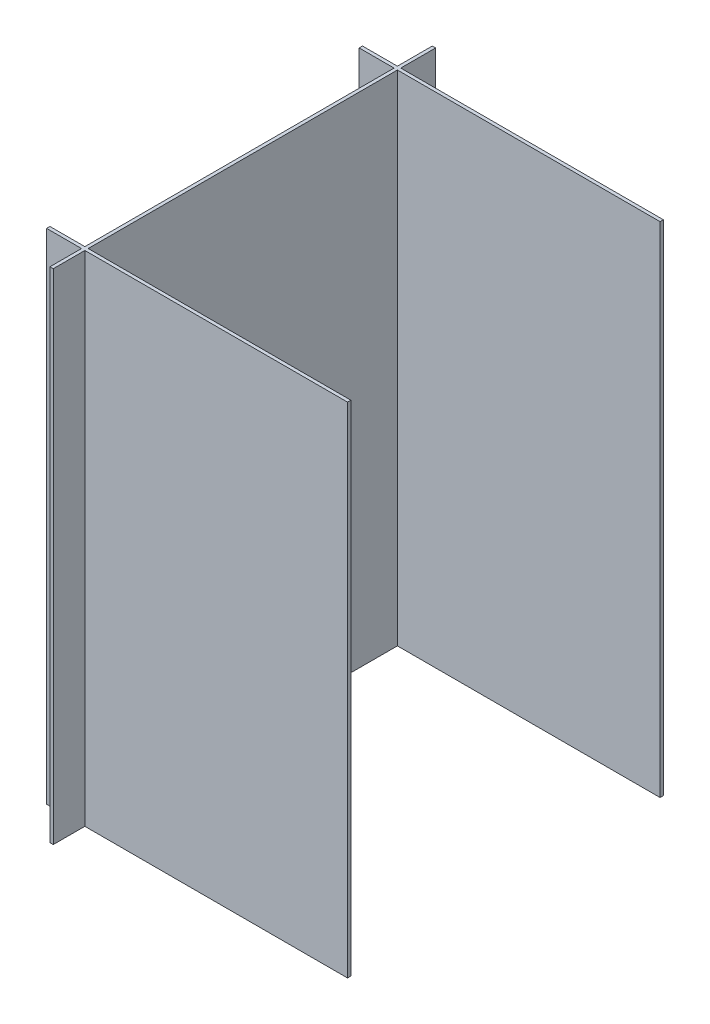
from build123d import *

# Parameters (mm, degrees)
BOSS_EXTRUDE1_DEPTH = 300


with BuildPart() as part:
    # Sketch1 → Boss-Extrude1 (new body)
    with BuildSketch(Plane(origin=(0, 0, 0), x_dir=(1, 0, 0), z_dir=(0, 1, 0))):
        Polygon((-56.161611152, -42.302266887), (-35.161611152, -42.302266887), (-35.161611152, -21.302266887), (-33.161611152, -21.302266887), (-33.161611152, -42.302266887), (124.838388848, -42.302266887), (124.838388848, -44.302266887), (-33.161611152, -44.302266887), (-33.161611152, -230.302266887), (124.838388848, -230.302266887), (124.838388848, -232.302266887), (-33.161611152, -232.302266887), (-33.161611152, -251.302266887), (-35.161611152, -251.302266887), (-35.161611152, -232.302266887), (-56.161611152, -232.302266887), (-56.161611152, -230.302266887), (-35.161611152, -230.302266887), (-35.161611152, -44.302266887), (-56.161611152, -44.302266887), align=None)
    extrude(amount=BOSS_EXTRUDE1_DEPTH)


solid = part.part
